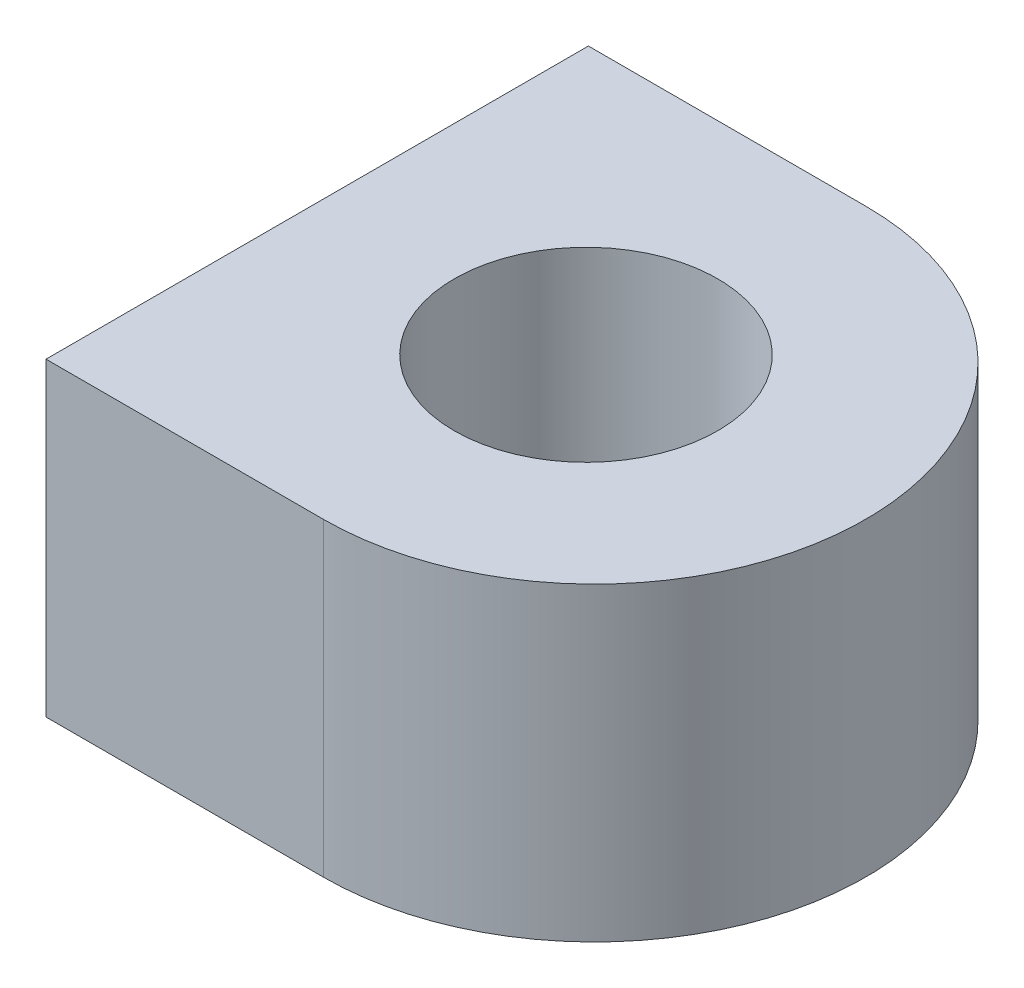
from build123d import *

# Parameters (mm, degrees)
SKETCH1_R           = 1.7
BOSS_EXTRUDE2_DEPTH = 4


with BuildPart() as part:
    # Sketch1 → Boss-Extrude2 (new body)
    with BuildSketch(Plane(origin=(0, 0, 0), x_dir=(1, 0, 0), z_dir=(0, 1, 0))):
        with BuildLine():
            Line((-3.435794878, -0.033363683), (-3.435794878, 3.466636317))
            Line((-3.435794878, 3.466636317), (0.143666226, 3.466636317))
            ThreePointArc((0.143666226, 3.466636317), (3.643666226, -0.033363683), (0.143666226, -3.533363683))
            Line((0.143666226, -3.533363683), (-3.435794878, -3.533363683))
            Line((-3.435794878, -3.533363683), (-3.435794878, -0.033363683))
        make_face()
        with Locations(Location((0, 0, 0), (0, 0, 270))):
            Circle(SKETCH1_R, mode=Mode.SUBTRACT)
    extrude(amount=BOSS_EXTRUDE2_DEPTH)


solid = part.part
